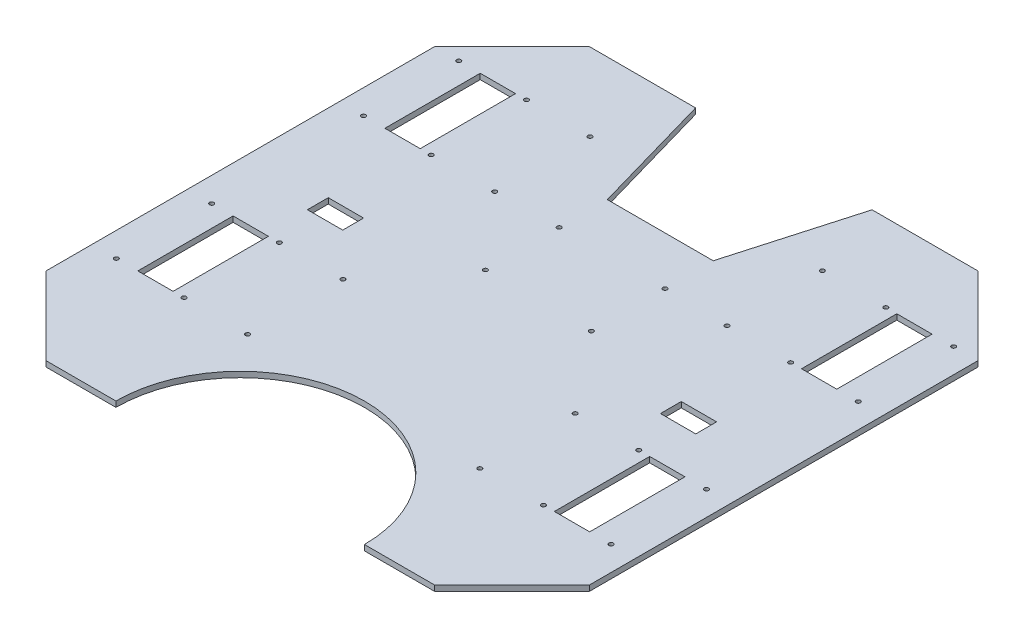
from build123d import *

# Parameters (mm, degrees)
EXTRUDE_1_DEPTH        = 4
SKETCH_1_4_OUTSIDE_W   = 503.8
SKETCH_1_4_OUTSIDE_H   = 503.8
SKETCH_1_4_OUTSIDE_R   = 1.55
SKETCH_1_4_OUTSIDE_W_2 = 25.4
SKETCH_1_4_OUTSIDE_H_2 = 68.58
SKETCH_1_4_OUTSIDE_H_3 = 15
CUT_EXTRUDE_2_DEPTH    = 4


with BuildPart() as part:
    # 草图1 → 凸台-拉伸1 (new body)
    with BuildSketch(Plane(origin=(0, 0, 0), x_dir=(1, 0, 0), z_dir=(0, 1, 0))):
        with BuildLine():
            Line((139.7, -195.58), (89.408, -195.58))
            ThreePointArc((89.408, -195.58), (0, -106.172), (-89.408, -195.58))
            Line((-89.408, -195.58), (-139.7, -195.58))
            Line((-139.7, -195.58), (-195.58, -139.7))
            Line((-195.58, -139.7), (-195.58, 139.7))
            Line((-195.58, 139.7), (-139.7, 195.58))
            Line((-139.7, 195.58), (-63.5, 195.58))
            Line((-63.5, 195.58), (-38.1, 106.68))
            Line((-38.1, 106.68), (38.1, 106.68))
            Line((38.1, 106.68), (63.5, 195.58))
            Line((63.5, 195.58), (139.7, 195.58))
            Line((139.7, 195.58), (195.58, 139.7))
            Line((195.58, 139.7), (195.58, -139.7))
            Line((195.58, -139.7), (139.7, -195.58))
        make_face()
    extrude(amount=EXTRUDE_1_DEPTH)

    # 草图1<4> outside → 切除-拉伸2 (cut)
    # profile 1 of 35: a face of its own
    with BuildSketch(Plane(origin=(0, 0, 0), x_dir=(1, 0, 0), z_dir=(0, 1, 0))):
        Rectangle(SKETCH_1_4_OUTSIDE_W, SKETCH_1_4_OUTSIDE_H)
        with BuildLine():
            Line((139.7, -195.58), (89.408, -195.58))
            ThreePointArc((89.408, -195.58), (0, -106.172), (-89.408, -195.58))
            Line((-89.408, -195.58), (-139.7, -195.58))
            Line((-139.7, -195.58), (-195.58, -139.7))
            Line((-195.58, -139.7), (-195.58, 139.7))
            Line((-195.58, 139.7), (-139.7, 195.58))
            Line((-139.7, 195.58), (-63.5, 195.58))
            Line((-63.5, 195.58), (-38.1, 106.68))
            Line((-38.1, 106.68), (38.1, 106.68))
            Line((38.1, 106.68), (63.5, 195.58))
            Line((63.5, 195.58), (139.7, 195.58))
            Line((139.7, 195.58), (195.58, 139.7))
            Line((195.58, 139.7), (195.58, -139.7))
            Line((195.58, -139.7), (139.7, -195.58))
        make_face(mode=Mode.SUBTRACT)
    # profile 2 of 35: a face of its own
    with BuildSketch(Plane(origin=(0, 0, 0), x_dir=(1, 0, 0), z_dir=(0, 1, 0))):
        with Locations((-83.566, 139.7)):
            Circle(SKETCH_1_4_OUTSIDE_R)
    # profile 3 of 35: a face of its own
    with BuildSketch(Plane(origin=(0, 0, 0), x_dir=(1, 0, 0), z_dir=(0, 1, 0))):
        with Locations((-129.286, 139.7)):
            Circle(SKETCH_1_4_OUTSIDE_R)
    # profile 4 of 35: a face of its own
    with BuildSketch(Plane(origin=(0, 0, 0), x_dir=(1, 0, 0), z_dir=(0, 1, 0))):
        with Locations((-83.566, -106.68)):
            Circle(SKETCH_1_4_OUTSIDE_R)
    # profile 5 of 35: a face of its own
    with BuildSketch(Plane(origin=(0, 0, 0), x_dir=(1, 0, 0), z_dir=(0, 1, 0))):
        with Locations((-129.286, -106.68)):
            Circle(SKETCH_1_4_OUTSIDE_R)
    # profile 6 of 35: a face of its own
    with BuildSketch(Plane(origin=(0, 0, 0), x_dir=(1, 0, 0), z_dir=(0, 1, 0))):
        with Locations((83.566, 139.7)):
            Circle(SKETCH_1_4_OUTSIDE_R)
    # profile 7 of 35: a face of its own
    with BuildSketch(Plane(origin=(0, 0, 0), x_dir=(1, 0, 0), z_dir=(0, 1, 0))):
        with Locations((129.286, 139.7)):
            Circle(SKETCH_1_4_OUTSIDE_R)
    # profile 8 of 35: a face of its own
    with BuildSketch(Plane(origin=(0, 0, 0), x_dir=(1, 0, 0), z_dir=(0, 1, 0))):
        with Locations((83.566, -106.68)):
            Circle(SKETCH_1_4_OUTSIDE_R)
    # profile 9 of 35: a face of its own
    with BuildSketch(Plane(origin=(0, 0, 0), x_dir=(1, 0, 0), z_dir=(0, 1, 0))):
        with Locations((129.286, -106.68)):
            Circle(SKETCH_1_4_OUTSIDE_R)
    # profile 10 of 35: a face of its own
    with BuildSketch(Plane(origin=(0, 0, 0), x_dir=(1, 0, 0), z_dir=(0, 1, 0))):
        with Locations((-129.286, 71.12)):
            Circle(SKETCH_1_4_OUTSIDE_R)
    # profile 11 of 35: a face of its own
    with BuildSketch(Plane(origin=(0, 0, 0), x_dir=(1, 0, 0), z_dir=(0, 1, 0))):
        with Locations((-83.566, 71.12)):
            Circle(SKETCH_1_4_OUTSIDE_R)
    # profile 12 of 35: a face of its own
    with BuildSketch(Plane(origin=(0, 0, 0), x_dir=(1, 0, 0), z_dir=(0, 1, 0))):
        with Locations((83.566, 71.12)):
            Circle(SKETCH_1_4_OUTSIDE_R)
    # profile 13 of 35: a face of its own
    with BuildSketch(Plane(origin=(0, 0, 0), x_dir=(1, 0, 0), z_dir=(0, 1, 0))):
        with Locations((129.286, 71.12)):
            Circle(SKETCH_1_4_OUTSIDE_R)
    # profile 14 of 35: a face of its own
    with BuildSketch(Plane(origin=(0, 0, 0), x_dir=(1, 0, 0), z_dir=(0, 1, 0))):
        with Locations((-129.286, -38.1)):
            Circle(SKETCH_1_4_OUTSIDE_R)
    # profile 15 of 35: a face of its own
    with BuildSketch(Plane(origin=(0, 0, 0), x_dir=(1, 0, 0), z_dir=(0, 1, 0))):
        with Locations((-83.566, -38.1)):
            Circle(SKETCH_1_4_OUTSIDE_R)
    # profile 16 of 35: a face of its own
    with BuildSketch(Plane(origin=(0, 0, 0), x_dir=(1, 0, 0), z_dir=(0, 1, 0))):
        with Locations((83.566, -38.1)):
            Circle(SKETCH_1_4_OUTSIDE_R)
    # profile 17 of 35: a face of its own
    with BuildSketch(Plane(origin=(0, 0, 0), x_dir=(1, 0, 0), z_dir=(0, 1, 0))):
        with Locations((129.286, -38.1)):
            Circle(SKETCH_1_4_OUTSIDE_R)
    # profile 18 of 35: a face of its own
    with BuildSketch(Plane(origin=(0, 0, 0), x_dir=(1, 0, 0), z_dir=(0, 1, 0))):
        with Locations((-178, -38.1)):
            Circle(SKETCH_1_4_OUTSIDE_R)
    # profile 19 of 35: a face of its own
    with BuildSketch(Plane(origin=(0, 0, 0), x_dir=(1, 0, 0), z_dir=(0, 1, 0))):
        with Locations((-178, -106.68)):
            Circle(SKETCH_1_4_OUTSIDE_R)
    # profile 20 of 35: a face of its own
    with BuildSketch(Plane(origin=(0, 0, 0), x_dir=(1, 0, 0), z_dir=(0, 1, 0))):
        with Locations((178, -106.68)):
            Circle(SKETCH_1_4_OUTSIDE_R)
    # profile 21 of 35: a face of its own
    with BuildSketch(Plane(origin=(0, 0, 0), x_dir=(1, 0, 0), z_dir=(0, 1, 0))):
        with Locations((178, -38.1)):
            Circle(SKETCH_1_4_OUTSIDE_R)
    # profile 22 of 35: a face of its own
    with BuildSketch(Plane(origin=(0, 0, 0), x_dir=(1, 0, 0), z_dir=(0, 1, 0))):
        with Locations((-178, 139.7)):
            Circle(SKETCH_1_4_OUTSIDE_R)
    # profile 23 of 35: a face of its own
    with BuildSketch(Plane(origin=(0, 0, 0), x_dir=(1, 0, 0), z_dir=(0, 1, 0))):
        with Locations((-178, 71.12)):
            Circle(SKETCH_1_4_OUTSIDE_R)
    # profile 24 of 35: a face of its own
    with BuildSketch(Plane(origin=(0, 0, 0), x_dir=(1, 0, 0), z_dir=(0, 1, 0))):
        with Locations((178, 139.7)):
            Circle(SKETCH_1_4_OUTSIDE_R)
    # profile 25 of 35: a face of its own
    with BuildSketch(Plane(origin=(0, 0, 0), x_dir=(1, 0, 0), z_dir=(0, 1, 0))):
        with Locations((178, 71.12)):
            Circle(SKETCH_1_4_OUTSIDE_R)
    # profile 26 of 35: a face of its own
    with BuildSketch(Plane(origin=(0, 0, 0), x_dir=(1, 0, 0), z_dir=(0, 1, 0))):
        with Locations((-38.1, 72)):
            Circle(SKETCH_1_4_OUTSIDE_R)
    # profile 27 of 35: a face of its own
    with BuildSketch(Plane(origin=(0, 0, 0), x_dir=(1, 0, 0), z_dir=(0, 1, 0))):
        with Locations((38.1, 72)):
            Circle(SKETCH_1_4_OUTSIDE_R)
    # profile 28 of 35: a face of its own
    with BuildSketch(Plane(origin=(0, 0, 0), x_dir=(1, 0, 0), z_dir=(0, 1, 0))):
        with Locations((-38.1, 19)):
            Circle(SKETCH_1_4_OUTSIDE_R)
    # profile 29 of 35: a face of its own
    with BuildSketch(Plane(origin=(0, 0, 0), x_dir=(1, 0, 0), z_dir=(0, 1, 0))):
        with Locations((38.1, 19)):
            Circle(SKETCH_1_4_OUTSIDE_R)
    # profile 30 of 35: a face of its own
    with BuildSketch(Plane(origin=(0, 0, 0), x_dir=(1, 0, 0), z_dir=(0, 1, 0))):
        with Locations((-149.86, 105.41)):
            Rectangle(SKETCH_1_4_OUTSIDE_W_2, SKETCH_1_4_OUTSIDE_H_2)
    # profile 31 of 35: a face of its own
    with BuildSketch(Plane(origin=(0, 0, 0), x_dir=(1, 0, 0), z_dir=(0, 1, 0))):
        with Locations((149.86, 105.41)):
            Rectangle(SKETCH_1_4_OUTSIDE_W_2, SKETCH_1_4_OUTSIDE_H_2)
    # profile 32 of 35: a face of its own
    with BuildSketch(Plane(origin=(0, 0, 0), x_dir=(1, 0, 0), z_dir=(0, 1, 0))):
        with Locations((149.86, -72.39)):
            Rectangle(SKETCH_1_4_OUTSIDE_W_2, SKETCH_1_4_OUTSIDE_H_2)
    # profile 33 of 35: a face of its own
    with BuildSketch(Plane(origin=(0, 0, 0), x_dir=(1, 0, 0), z_dir=(0, 1, 0))):
        with Locations((-149.86, -72.39)):
            Rectangle(SKETCH_1_4_OUTSIDE_W_2, SKETCH_1_4_OUTSIDE_H_2)
    # profile 34 of 35: a face of its own
    with BuildSketch(Plane(origin=(0, 0, 0), x_dir=(1, 0, 0), z_dir=(0, 1, 0))):
        with Locations((-127, 0)):
            Rectangle(SKETCH_1_4_OUTSIDE_W_2, SKETCH_1_4_OUTSIDE_H_3)
    # profile 35 of 35: a face of its own
    with BuildSketch(Plane(origin=(0, 0, 0), x_dir=(1, 0, 0), z_dir=(0, 1, 0))):
        with Locations((127, 0)):
            Rectangle(SKETCH_1_4_OUTSIDE_W_2, SKETCH_1_4_OUTSIDE_H_3)
    extrude(amount=CUT_EXTRUDE_2_DEPTH, mode=Mode.SUBTRACT)


solid = part.part
